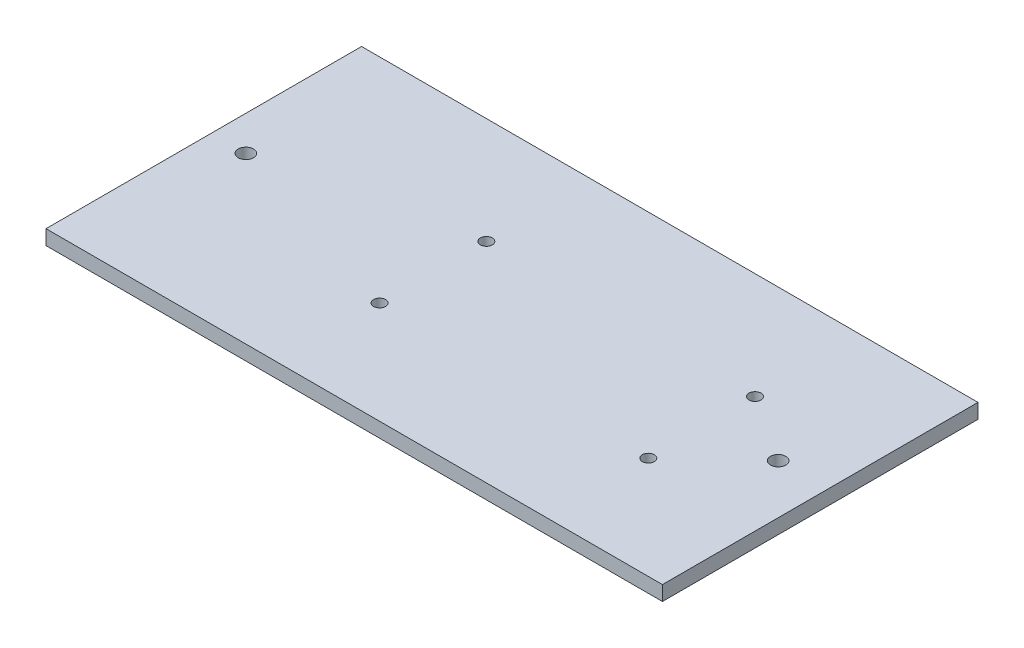
from build123d import *

# Parameters (mm, degrees)
SKETCH1_W           = 133.175
SKETCH1_H           = 68.175
SKETCH1_R           = 1.65
BOSS_EXTRUDE1_DEPTH = 3.175
SKETCH2_R           = 1.3
CUT_EXTRUDE1_DEPTH  = 3.175


with BuildPart() as part:
    # Sketch1 → Boss-Extrude1 (new body)
    with BuildSketch(Plane(origin=(0, 0, 0), x_dir=(1, 0, 0), z_dir=(0, 1, 0))):
        Rectangle(SKETCH1_W, SKETCH1_H)
        with Locations(Location((-59.0875, 1.5875, 0), (0, 0, 270))):
            Circle(SKETCH1_R, mode=Mode.SUBTRACT)
        with Locations(Location((55.9125, 1.5875, 0), (0, 0, 270))):
            Circle(SKETCH1_R, mode=Mode.SUBTRACT)
    extrude(amount=BOSS_EXTRUDE1_DEPTH)

    # Sketch2 → Cut-Extrude1 (cut)
    with BuildSketch(Plane.XZ):
        with Locations(Location((-16.6375, 11.9625, 0), (0, 0, 270))):
            Circle(SKETCH2_R)
        with Locations(Location((-16.6375, -11.0875, 0), (0, 0, 270))):
            Circle(SKETCH2_R)
        with Locations(Location((41.4125, -11.0875, 0), (0, 0, 270))):
            Circle(SKETCH2_R)
        with Locations(Location((41.4125, 11.9625, 0), (0, 0, 270))):
            Circle(SKETCH2_R)
    extrude(amount=-CUT_EXTRUDE1_DEPTH, mode=Mode.SUBTRACT)


solid = part.part
